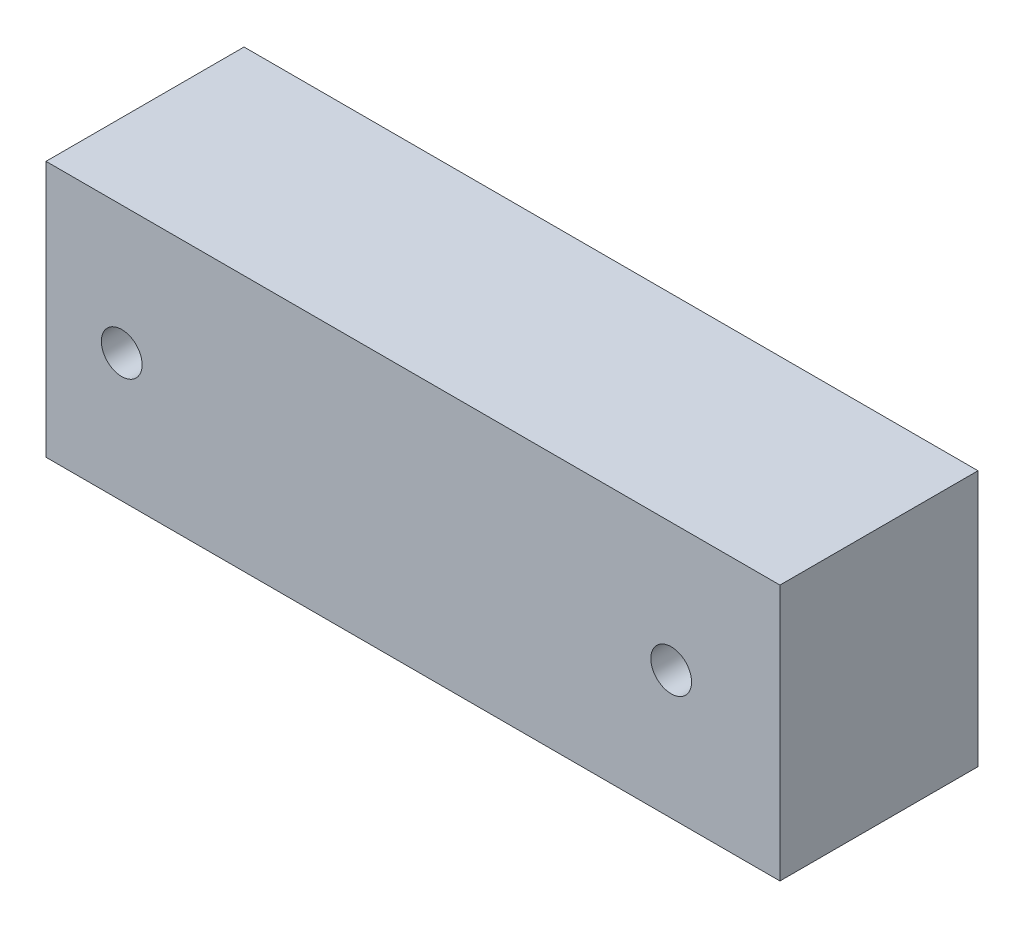
from build123d import *

# Parameters (mm, degrees)
SKETCH1_W           = 63
SKETCH1_H           = 22
BOSS_EXTRUDE1_DEPTH = 17
SKETCH2_R           = 1.75
CUT_EXTRUDE1_DEPTH  = 38.446628687


with BuildPart() as part:
    # Sketch1 → Boss-Extrude1 (new body)
    with BuildSketch(Plane.XY):
        Rectangle(SKETCH1_W, SKETCH1_H)
    extrude(amount=BOSS_EXTRUDE1_DEPTH)

    # Sketch2 → Cut-Extrude1 (cut, through all)
    with BuildSketch(Plane.XY.offset(17)):
        with Locations((-25, 0)):
            Circle(SKETCH2_R)
        with Locations((22.165564566, 0)):
            Circle(SKETCH2_R)
    extrude(amount=-CUT_EXTRUDE1_DEPTH, mode=Mode.SUBTRACT)


solid = part.part
